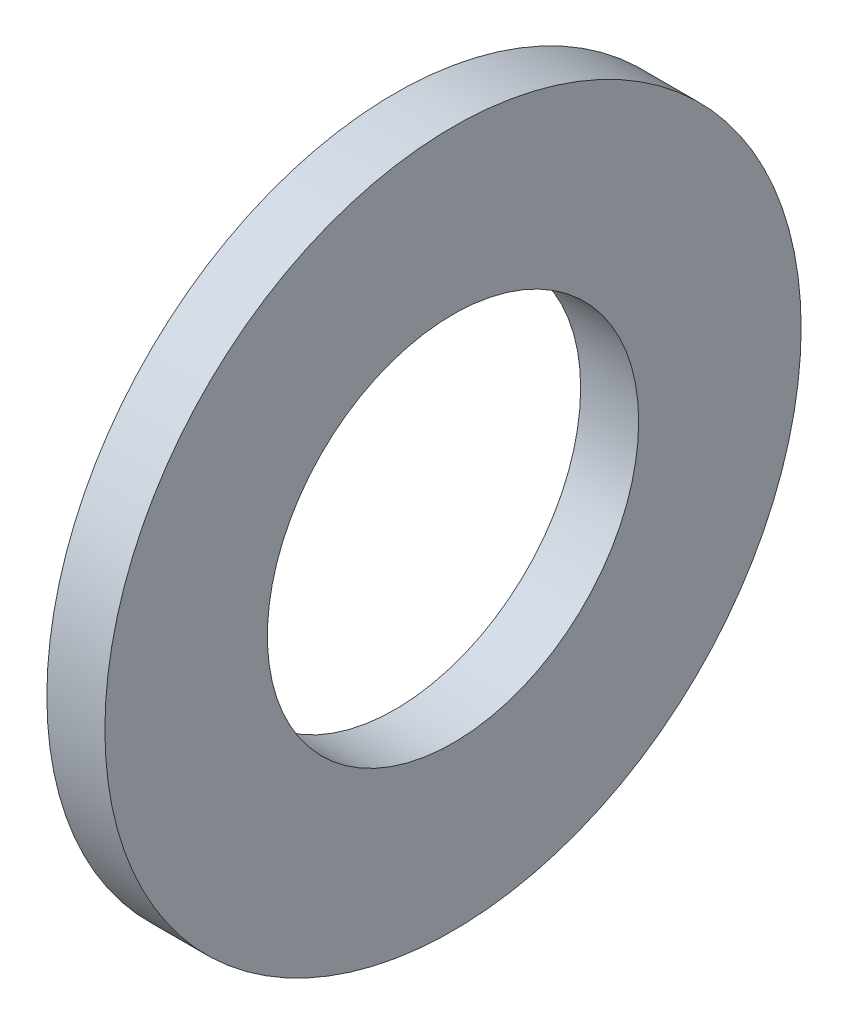
from build123d import *

# Parameters (mm, degrees)
PART_RING_OUTSIDE_SKETCH_R = 6
PART_RING_OUTSIDE_DEPTH    = 1
PART_RING_BORE_SKETCH_R    = 3.2
PART_RING_BORE_DEPTH       = 1.2


with BuildPart() as part:
    # Part ring outside sketch → Part ring outside (new body)
    with BuildSketch(Plane(origin=(19.5, 0, 0), x_dir=(0, 0, -1), z_dir=(1, 0, 0))):
        with Locations((19.5, -29)):
            Circle(PART_RING_OUTSIDE_SKETCH_R)
    extrude(amount=PART_RING_OUTSIDE_DEPTH)

    # Part ring bore sketch → Part ring bore (cut)
    with BuildSketch(Plane(origin=(19.4, 0, 0), x_dir=(0, 0, -1), z_dir=(1, 0, 0))):
        with Locations((19.5, -29)):
            Circle(PART_RING_BORE_SKETCH_R)
    extrude(amount=PART_RING_BORE_DEPTH, mode=Mode.SUBTRACT)


solid = part.part
